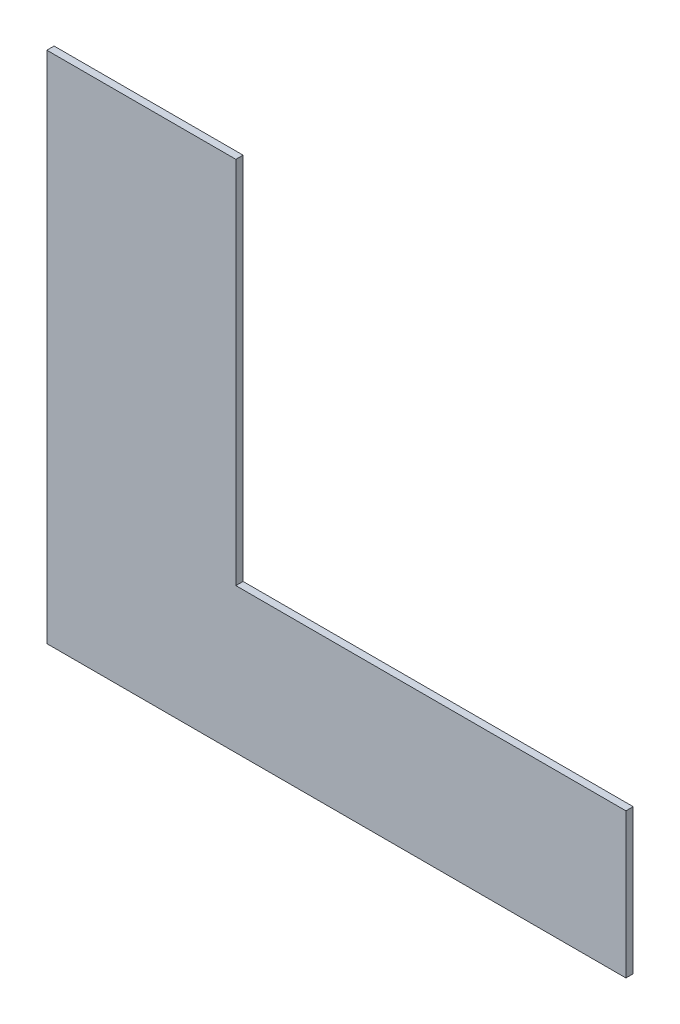
from build123d import *

# Parameters (mm, degrees)
BOSS_EXTRU_1_DEPTH = 5


with BuildPart() as part:
    # Esquisse1 → Boss.-Extru.1 (new body)
    with BuildSketch(Plane.XY):
        Polygon((-198.955968468, 177.126470588), (-198.955968468, -177.873529412), (201.044031532, -177.873529412), (201.044031532, -77.873529412), (-68.385968468, -77.873529412), (-68.385968468, 177.126470588), align=None)
    extrude(amount=BOSS_EXTRU_1_DEPTH)


solid = part.part
